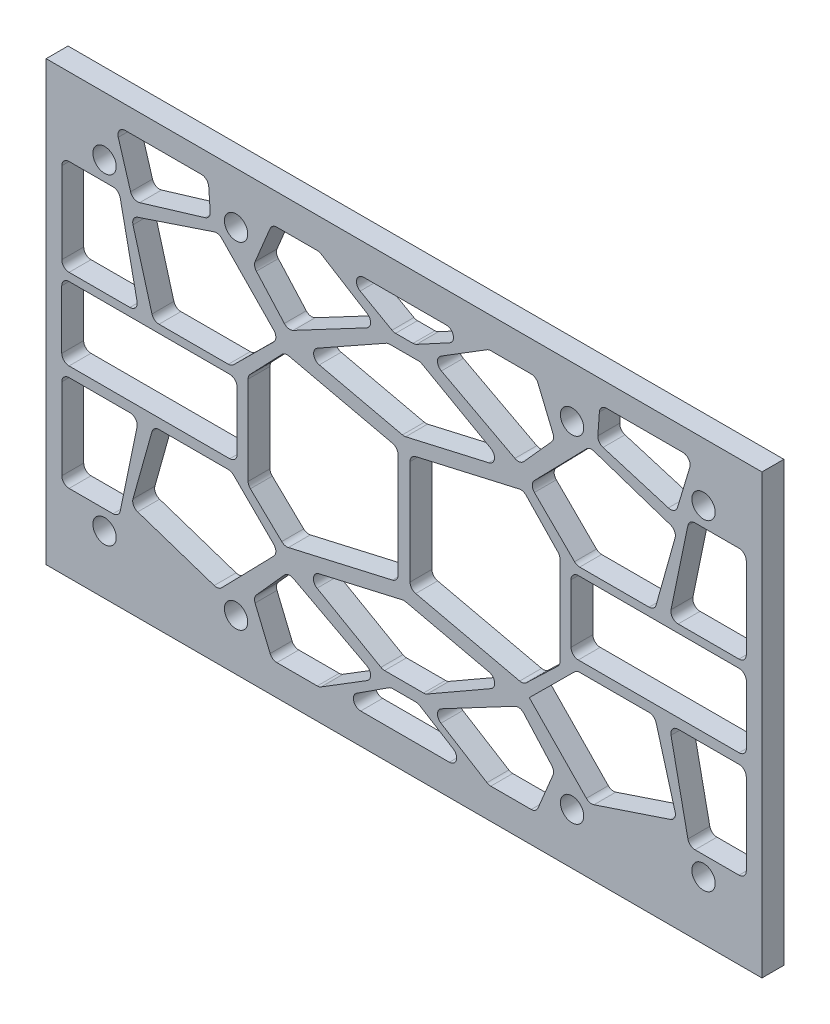
from build123d import *

# Parameters (mm, degrees)
SKETCH_1_W      = 98
SKETCH_1_H      = 60
SKETCH_1_R      = 1.6
SKETCH_1_W_2    = 24.005236688
SKETCH_1_H_2    = 10.01203632
EXTRUDE_1_DEPTH = 3
FILLET_1_R      = 1


with BuildPart() as part:
    # 草图1 → 凸台-拉伸1 (new body)
    with BuildSketch(Plane.XY):
        with Locations((49, 30)):
            Rectangle(SKETCH_1_W, SKETCH_1_H)
        with Locations((8, 8)):
            Circle(SKETCH_1_R, mode=Mode.SUBTRACT)
        with Locations(Location((90, 8, 0), (0, 0, 180))):
            Circle(SKETCH_1_R, mode=Mode.SUBTRACT)
        with Locations((90, 52)):
            Circle(SKETCH_1_R, mode=Mode.SUBTRACT)
        with Locations(Location((8, 52, 0), (0, 0, 180))):
            Circle(SKETCH_1_R, mode=Mode.SUBTRACT)
        with Locations((26, 53)):
            Circle(SKETCH_1_R, mode=Mode.SUBTRACT)
        with Locations((26, 7)):
            Circle(SKETCH_1_R, mode=Mode.SUBTRACT)
        with Locations(Location((72, 7, 0), (0, 0, 180))):
            Circle(SKETCH_1_R, mode=Mode.SUBTRACT)
        with Locations(Location((72, 53, 0), (0, 0, 180))):
            Circle(SKETCH_1_R, mode=Mode.SUBTRACT)
        Polygon((34.870719996, 42.966049725), (49, 39.731705799), (63.129280004, 42.966049725), (51.230462681, 49.658437917), (46.769537319, 49.658437917), align=None, mode=Mode.SUBTRACT)
        Polygon((49.820719298, 37.939478062), (65.325825273, 41.488763328), (70.346967451, 36.241299432), (70.346967451, 23.280380091), (65.35571126, 18.504395449), (49.820719298, 22.060521938), align=None, mode=Mode.SUBTRACT)
        Polygon((49, 20.268294201), (63.129280004, 17.033950275), (51.93386277, 10.620551246), (46.06613723, 10.620551246), (34.870719996, 17.033950275), align=None, mode=Mode.SUBTRACT)
        Polygon((33.134695872, 44.33025405), (28.365664039, 49.658437917), (30.922990861, 55.812678053), (37.406188314, 55.812678053), (45.430482341, 50.842991747), align=None, mode=Mode.SUBTRACT)
        Polygon((32.64428874, 18.504395449), (48.179280702, 22.060521938), (48.179280702, 37.939478062), (32.674174727, 41.488763328), (27.653032549, 36.241299432), (27.653032549, 23.280380091), align=None, mode=Mode.SUBTRACT)
        Polygon((52.569517659, 50.842991747), (64.865304128, 44.33025405), (69.634335961, 49.658437917), (67.077009139, 55.812678053), (60.593811686, 55.812678053), align=None, mode=Mode.SUBTRACT)
        Polygon((60.593811686, 4.187321947), (52.569517659, 9.157008253), (64.865304128, 15.66974595), (69.634335961, 10.341562083), (67.077009139, 4.187321947), align=None, mode=Mode.SUBTRACT)
        Polygon((45.430482341, 9.157008253), (33.134695872, 15.66974595), (28.365664039, 10.341562083), (30.922990861, 4.187321947), (37.406188314, 4.187321947), align=None, mode=Mode.SUBTRACT)
        Polygon((47.172992688, 9.029929547), (39.66951379, 4.187321947), (58.722965541, 4.187321947), (50.903858892, 9.029929547), align=None, mode=Mode.SUBTRACT)
        Polygon((39.66951379, 55.812678053), (58.722965541, 55.812678053), (50.480247945, 51.35715529), (47.579504064, 51.35715529), align=None, mode=Mode.SUBTRACT)
        Polygon((66.143612127, 42.686715193), (74.39917741, 51.163063301), (86.367769888, 47.164162693), (83.305191448, 36.241299432), (72.636840863, 36.241299432), align=None, mode=Mode.SUBTRACT)
        Polygon((14.694808552, 36.241299432), (25.363159137, 36.241299432), (31.856387873, 42.686715193), (23.60082259, 51.163063301), (11.632230112, 47.164162693), align=None, mode=Mode.SUBTRACT)
        with Locations((83.860324301, 30.141476285)):
            Rectangle(SKETCH_1_W_2, SKETCH_1_H_2, mode=Mode.SUBTRACT)
        Polygon((83.305191448, 23.758700568), (72.636840863, 23.758700568), (66.143612127, 17.313284807), (74.39917741, 8.836936699), (86.367769888, 12.835837307), align=None, mode=Mode.SUBTRACT)
        Polygon((11.632230112, 12.835837307), (14.694808552, 23.758700568), (25.363159137, 23.758700568), (31.856387873, 17.313284807), (23.60082259, 8.836936699), align=None, mode=Mode.SUBTRACT)
        with Locations((14.139675699, 30.141476285)):
            Rectangle(SKETCH_1_W_2, SKETCH_1_H_2, mode=Mode.SUBTRACT)
        Polygon((85.299061804, 36.241299432), (88.027197648, 49.379448754), (95.853851824, 49.379448754), (95.853851824, 36.241299432), align=None, mode=Mode.SUBTRACT)
        Polygon((2.146148176, 49.379448754), (2.146148176, 36.241299432), (12.700938196, 36.241299432), (9.972802352, 49.379448754), align=None, mode=Mode.SUBTRACT)
        Polygon((95.853851824, 10.620551246), (95.853851824, 23.758700568), (85.299061804, 23.758700568), (88.027197648, 10.620551246), align=None, mode=Mode.SUBTRACT)
        Polygon((9.972802352, 10.620551246), (2.146148176, 10.620551246), (2.146148176, 23.758700568), (12.700938196, 23.758700568), align=None, mode=Mode.SUBTRACT)
        Polygon((75.805512284, 56.904191489), (75.479147888, 52.256319465), (86.148316014, 49.043832527), (88.515070403, 56.904191489), align=None, mode=Mode.SUBTRACT)
        Polygon((11.851683986, 49.043832527), (9.484929597, 56.904191489), (22.194487716, 56.904191489), (22.520852112, 52.256319465), align=None, mode=Mode.SUBTRACT)
    extrude(amount=EXTRUDE_1_DEPTH)

    # 圆角1
    fillet_1_edges = [part.edges().sort_by_distance(p)[0] for p in [
        (83.305191448, 36.241299432, 1.5),
        (86.367769888, 47.164162693, 1.5),
        (74.39917741, 51.163063301, 1.5),
        (66.143612127, 42.686715193, 1.5),
        (72.636840863, 36.241299432, 1.5),
        (71.857705957, 35.147494445, 1.5),
        (71.857705957, 25.135458125, 1.5),
        (95.862942645, 25.135458125, 1.5),
        (95.862942645, 35.147494445, 1.5),
        (60.593811686, 4.187321947, 1.5),
        (67.077009139, 4.187321947, 1.5),
        (69.634335961, 10.341562083, 1.5),
        (64.865304128, 15.66974595, 1.5),
        (52.569517659, 9.157008253, 1.5),
        (11.632230112, 47.164162693, 1.5),
        (14.694808552, 36.241299432, 1.5),
        (25.363159137, 36.241299432, 1.5),
        (31.856387873, 42.686715193, 1.5),
        (23.60082259, 51.163063301, 1.5),
        (37.406188314, 4.187321947, 1.5),
        (45.430482341, 9.157008253, 1.5),
        (33.134695872, 15.66974595, 1.5),
        (28.365664039, 10.341562083, 1.5),
        (30.922990861, 4.187321947, 1.5),
        (86.367769888, 12.835837307, 1.5),
        (83.305191448, 23.758700568, 1.5),
        (72.636840863, 23.758700568, 1.5),
        (74.39917741, 8.836936699, 1.5),
        (49, 20.268294201, 1.5),
        (34.870719996, 17.033950275, 1.5),
        (46.06613723, 10.620551246, 1.5),
        (51.93386277, 10.620551246, 1.5),
        (63.129280004, 17.033950275, 1.5),
        (11.632230112, 12.835837307, 1.5),
        (23.60082259, 8.836936699, 1.5),
        (31.856387873, 17.313284807, 1.5),
        (25.363159137, 23.758700568, 1.5),
        (14.694808552, 23.758700568, 1.5),
        (95.853851824, 36.241299432, 1.5),
        (95.853851824, 49.379448754, 1.5),
        (88.027197648, 49.379448754, 1.5),
        (85.299061804, 36.241299432, 1.5),
        (26.142294043, 25.135458125, 1.5),
        (26.142294043, 35.147494445, 1.5),
        (2.137057355, 35.147494445, 1.5),
        (2.137057355, 25.135458125, 1.5),
        (39.66951379, 4.187321947, 1.5),
        (58.722965541, 4.187321947, 1.5),
        (50.903858892, 9.029929547, 1.5),
        (47.172992688, 9.029929547, 1.5),
        (30.922990861, 55.812678053, 1.5),
        (28.365664039, 49.658437917, 1.5),
        (33.134695872, 44.33025405, 1.5),
        (45.430482341, 50.842991747, 1.5),
        (37.406188314, 55.812678053, 1.5),
        (27.653032549, 23.280380091, 1.5),
        (32.64428874, 18.504395449, 1.5),
        (48.179280702, 22.060521938, 1.5),
        (48.179280702, 37.939478062, 1.5),
        (32.674174727, 41.488763328, 1.5),
        (27.653032549, 36.241299432, 1.5),
        (9.972802352, 49.379448754, 1.5),
        (2.146148176, 49.379448754, 1.5),
        (2.146148176, 36.241299432, 1.5),
        (12.700938196, 36.241299432, 1.5),
        (88.027197648, 10.620551246, 1.5),
        (95.853851824, 10.620551246, 1.5),
        (95.853851824, 23.758700568, 1.5),
        (85.299061804, 23.758700568, 1.5),
        (9.972802352, 10.620551246, 1.5),
        (12.700938196, 23.758700568, 1.5),
        (2.146148176, 23.758700568, 1.5),
        (2.146148176, 10.620551246, 1.5),
        (86.148316014, 49.043832527, 1.5),
        (88.515070403, 56.904191489, 1.5),
        (75.805512284, 56.904191489, 1.5),
        (75.479147888, 52.256319465, 1.5),
        (11.851683986, 49.043832527, 1.5),
        (22.520852112, 52.256319465, 1.5),
        (22.194487716, 56.904191489, 1.5),
        (9.484929597, 56.904191489, 1.5),
        (47.579504064, 51.35715529, 1.5),
        (50.480247945, 51.35715529, 1.5),
        (58.722965541, 55.812678053, 1.5),
        (39.66951379, 55.812678053, 1.5),
        (46.769537319, 49.658437917, 1.5),
        (34.870719996, 42.966049725, 1.5),
        (49, 39.731705799, 1.5),
        (63.129280004, 42.966049725, 1.5),
        (51.230462681, 49.658437917, 1.5),
        (49.820719298, 37.939478062, 1.5),
        (49.820719298, 22.060521938, 1.5),
        (65.35571126, 18.504395449, 1.5),
        (70.346967451, 23.280380091, 1.5),
        (70.346967451, 36.241299432, 1.5),
        (65.325825273, 41.488763328, 1.5),
        (60.593811686, 55.812678053, 1.5),
        (52.569517659, 50.842991747, 1.5),
        (64.865304128, 44.33025405, 1.5),
        (69.634335961, 49.658437917, 1.5),
        (67.077009139, 55.812678053, 1.5),
    ]]
    fillet(fillet_1_edges, radius=FILLET_1_R)


solid = part.part
